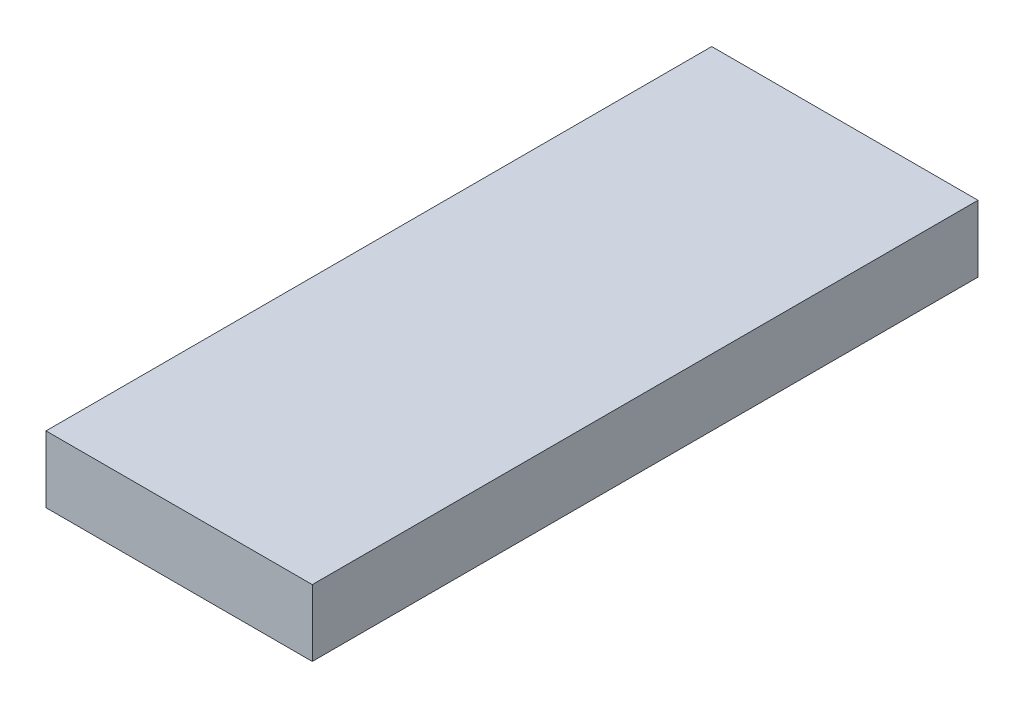
from build123d import *

# Parameters (mm, degrees)
ESQUISSE1_W        = 80
ESQUISSE1_H        = 20
BOSS_EXTRU_1_DEPTH = 200


with BuildPart() as part:
    # Esquisse1 → Boss.-Extru.1 (new body)
    with BuildSketch(Plane.XY):
        with Locations((40, 10)):
            Rectangle(ESQUISSE1_W, ESQUISSE1_H)
    extrude(amount=BOSS_EXTRU_1_DEPTH)


solid = part.part
